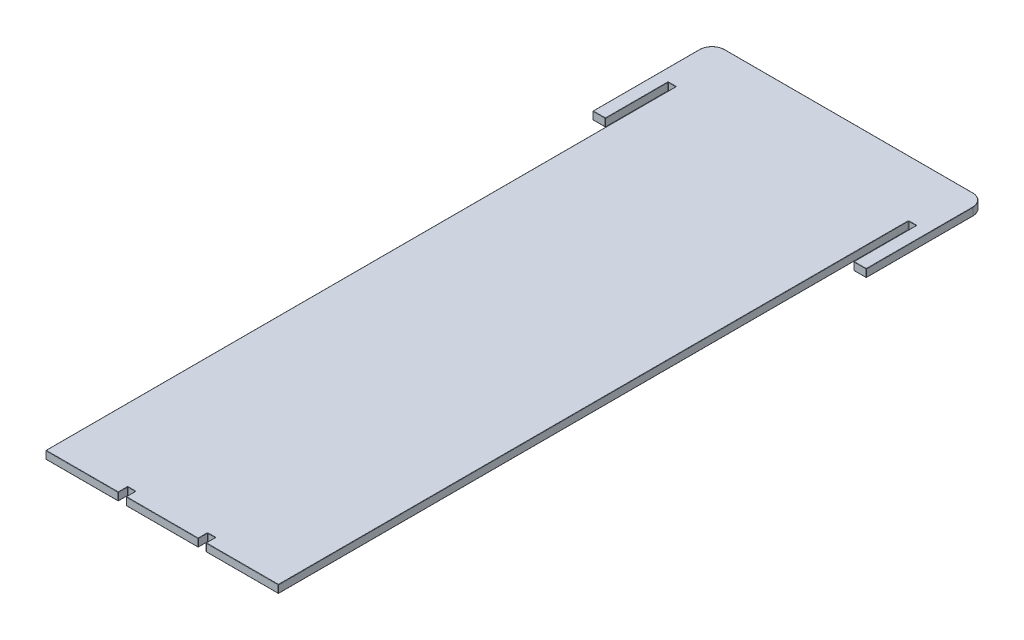
from build123d import *

# Parameters (mm, degrees)
ESBO_O1_W                = 74.2
ESBO_O1_H                = 19.98362215
RESSALTO_EXTRUS_O1_DEPTH = 2.5
FILETE1_R                = 0.1


with BuildPart() as part:
    # Esboço1 → Ressalto-extrusão1 (new body)
    with BuildSketch(Plane(origin=(0, 0, 0), x_dir=(1, 0, 0), z_dir=(0, 1, 0))):
        Polygon((-118.597641475, 16.814088048), (-192.797641475, 16.814088048), (-192.797641475, -164.202289802), (-169.697641475, -164.202289802), (-169.697641475, -161.202289802), (-167.197641475, -161.202289802), (-167.197641475, -164.202289802), (-144.197641475, -164.202289802), (-144.197641475, -161.202289802), (-141.697641475, -161.202289802), (-141.697641475, -164.202289802), (-118.597641475, -164.202289802), align=None)
        with Locations((-155.697641475, 26.805899123)):
            Rectangle(ESBO_O1_W, ESBO_O1_H)
        with BuildLine():
            Line((-195.297641475, 36.797710198), (-192.797641475, 36.797710198))
            Line((-192.797641475, 36.797710198), (-118.597641475, 36.797710198))
            Line((-118.597641475, 36.797710198), (-116.097641475, 36.797710198))
            Line((-116.097641475, 36.797710198), (-116.097641475, 16.814088048))
            Line((-116.097641475, 16.814088048), (-112.097641475, 16.814088048))
            Line((-112.097641475, 16.814088048), (-112.097641475, 50.814088048))
            ThreePointArc((-112.097641475, 50.814088048), (-113.26921435, 53.642515173), (-116.097641475, 54.814088048))
            Line((-116.097641475, 54.814088048), (-195.297641475, 54.814088048))
            ThreePointArc((-195.297641475, 54.814088048), (-198.126068599, 53.642515173), (-199.297641475, 50.814088048))
            Line((-199.297641475, 50.814088048), (-199.297641475, 16.814088048))
            Line((-199.297641475, 16.814088048), (-195.297641475, 16.814088048))
            Line((-195.297641475, 16.814088048), (-195.297641475, 36.797710198))
        make_face()
    extrude(amount=RESSALTO_EXTRUS_O1_DEPTH)

    # Filete1
    filete1_edges = [part.edges().sort_by_distance(p)[0] for p in [
        (-118.597641475, 2.5, 63.702289802),
        (-117.347641475, 2.5, -36.797710198),
        (-142.947641475, 0, 161.202289802),
        (-144.197641475, 0, 162.702289802),
        (-155.697641475, 0, 164.202289802),
        (-167.197641475, 0, 162.702289802),
        (-168.447641475, 0, 161.202289802),
        (-116.097641475, 2.5, -26.805899123),
        (-169.697641475, 0, 162.702289802),
        (-181.247641475, 0, 164.202289802),
        (-192.797641475, 0, 63.702289802),
        (-194.047641475, 0, -36.797710198),
        (-195.297641475, 0, -26.805899123),
        (-197.297641475, 0, -16.814088048),
        (-199.297641475, 0, -33.814088048),
        (-114.097641475, 2.5, -16.814088048),
        (-198.126068599, 0, -53.642515173),
        (-155.697641475, 0, -54.814088048),
        (-113.26921435, 0, -53.642515173),
        (-112.097641475, 0, -33.814088048),
        (-114.097641475, 0, -16.814088048),
        (-116.097641475, 0, -26.805899123),
        (-117.347641475, 0, -36.797710198),
        (-118.597641475, 0, 63.702289802),
        (-112.097641475, 2.5, -33.814088048),
        (-130.147641475, 0, 164.202289802),
        (-141.697641475, 0, 162.702289802),
        (-113.26921435, 2.5, -53.642515173),
        (-141.697641475, 1.25, 161.202289802),
        (-144.197641475, 1.25, 161.202289802),
        (-141.697641475, 2.5, 162.702289802),
        (-155.697641475, 2.5, -54.814088048),
        (-144.197641475, 1.25, 164.202289802),
        (-167.197641475, 1.25, 164.202289802),
        (-167.197641475, 1.25, 161.202289802),
        (-169.697641475, 1.25, 161.202289802),
        (-169.697641475, 1.25, 164.202289802),
        (-192.797641475, 1.25, 164.202289802),
        (-192.797641475, 1.25, -36.797710198),
        (-195.297641475, 1.25, -36.797710198),
        (-195.297641475, 1.25, -16.814088048),
        (-199.297641475, 1.25, -16.814088048),
        (-112.097641475, 1.25, -16.814088048),
        (-116.097641475, 1.25, -16.814088048),
        (-116.097641475, 1.25, -36.797710198),
        (-118.597641475, 1.25, -36.797710198),
        (-118.597641475, 1.25, 164.202289802),
        (-141.697641475, 1.25, 164.202289802),
        (-198.126068599, 2.5, -53.642515173),
        (-199.297641475, 2.5, -33.814088048),
        (-197.297641475, 2.5, -16.814088048),
        (-195.297641475, 2.5, -26.805899123),
        (-194.047641475, 2.5, -36.797710198),
        (-192.797641475, 2.5, 63.702289802),
        (-181.247641475, 2.5, 164.202289802),
        (-169.697641475, 2.5, 162.702289802),
        (-168.447641475, 2.5, 161.202289802),
        (-130.147641475, 2.5, 164.202289802),
        (-167.197641475, 2.5, 162.702289802),
        (-155.697641475, 2.5, 164.202289802),
        (-144.197641475, 2.5, 162.702289802),
        (-142.947641475, 2.5, 161.202289802),
    ]]
    fillet(filete1_edges, radius=FILETE1_R)


solid = part.part
